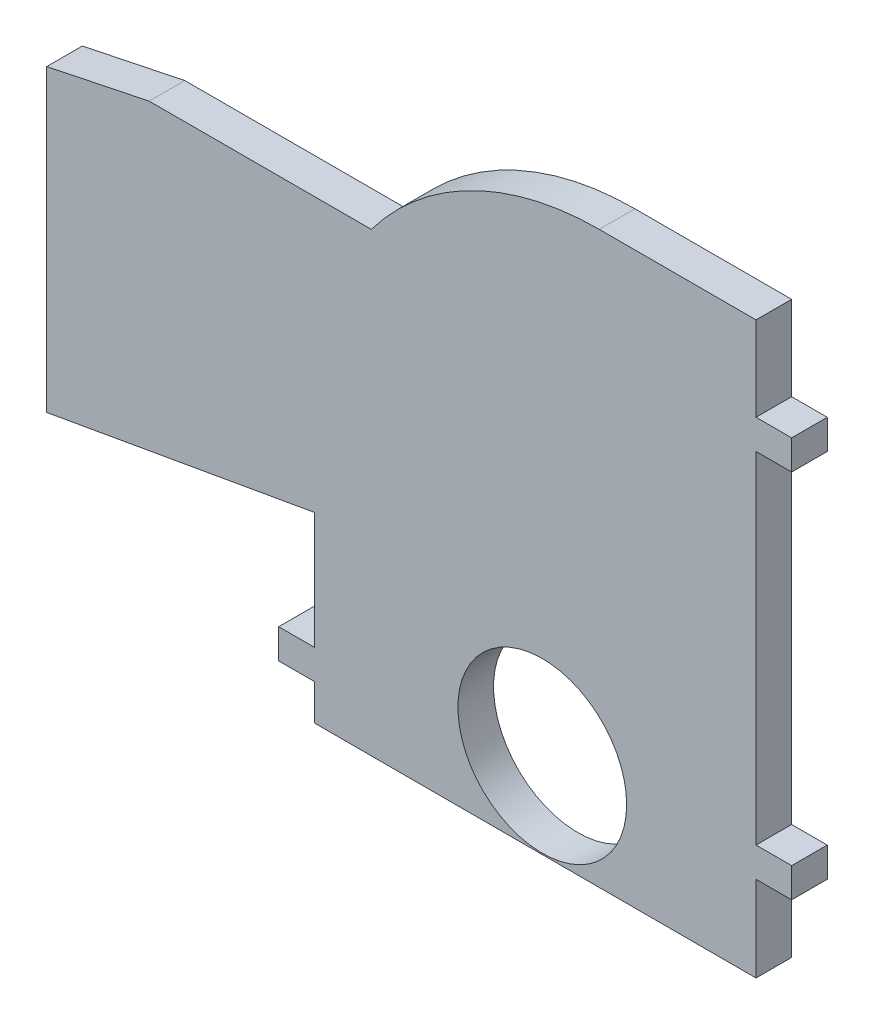
from build123d import *

# Parameters (mm, degrees)
SKETCH1_R           = 3.7592
SKETCH1_W           = 1.5875
SKETCH1_H           = 1.3208
BOSS_EXTRUDE1_DEPTH = 1.5875


with BuildPart() as part:
    # Sketch1 → Boss-Extrude1 (new body)
    # profile 1 of 6: a face of its own
    with BuildSketch(Plane.XY):
        with BuildLine():
            ThreePointArc((2.54, 21.59), (-3.139612663, 20.249225326), (-7.62, 16.51))
            ThreePointArc((-7.62, 16.51), (-9.508277885, 12.906092628), (-10.16, 8.89))
            Line((-10.16, 8.89), (-10.16, 4.318))
            Line((-10.16, 4.318), (-10.16, -0.889))
            Line((-10.16, -0.889), (-10.16, -2.2098))
            Line((-10.16, -2.2098), (-10.16, -3.81))
            Line((-10.16, -3.81), (9.525, -3.81))
            Line((9.525, -3.81), (9.525, 0))
            Line((9.525, 0), (9.525, 1.3208))
            Line((9.525, 1.3208), (9.525, 16.51))
            Line((9.525, 16.51), (9.525, 17.8308))
            Line((9.525, 17.8308), (9.525, 21.59))
            Line((9.525, 21.59), (2.54, 21.59))
        make_face()
        Circle(SKETCH1_R, mode=Mode.SUBTRACT)
    # profile 2 of 6: a face of its own
    with BuildSketch(Plane.XY):
        with Locations((-10.95375, -1.5494)):
            Rectangle(SKETCH1_W, SKETCH1_H)
    # profile 3 of 6: a face of its own
    with BuildSketch(Plane.XY):
        with Locations((10.31875, 17.1704)):
            Rectangle(SKETCH1_W, SKETCH1_H)
    # profile 4 of 6: a face of its own
    with BuildSketch(Plane.XY):
        with Locations((10.31875, 0.6604)):
            Rectangle(SKETCH1_W, SKETCH1_H)
    # profile 5 of 6: a face of its own
    with BuildSketch(Plane.XY):
        with BuildLine():
            ThreePointArc((-10.16, 8.89), (-9.508277885, 12.906092628), (-7.62, 16.51))
            Line((-7.62, 16.51), (-17.51946076, 16.51))
            Line((-17.51946076, 16.51), (-22.084921519, 15.561162564))
            Line((-22.084921519, 15.561162564), (-22.084921519, 13.081))
            Line((-22.084921519, 13.081), (-22.084921519, 4.699))
            Line((-22.084921519, 4.699), (-22.084921519, 2.212007412))
            Line((-22.084921519, 2.212007412), (-10.16, 4.318))
            Line((-10.16, 4.318), (-10.16, 8.89))
        make_face()
    # profile 6 of 6: a face of its own
    with BuildSketch(Plane.XY):
        with BuildLine():
            ThreePointArc((-10.16, 8.89), (-9.508277885, 12.906092628), (-7.62, 16.51))
            Line((-7.62, 16.51), (-17.51946076, 16.51))
            Line((-17.51946076, 16.51), (-22.084921519, 15.561162564))
            Line((-22.084921519, 15.561162564), (-22.084921519, 13.081))
            Line((-22.084921519, 13.081), (-22.084921519, 4.699))
            Line((-22.084921519, 4.699), (-22.084921519, 2.212007412))
            Line((-22.084921519, 2.212007412), (-10.16, 4.318))
            Line((-10.16, 4.318), (-10.16, 8.89))
        make_face()
    extrude(amount=BOSS_EXTRUDE1_DEPTH)


solid = part.part
